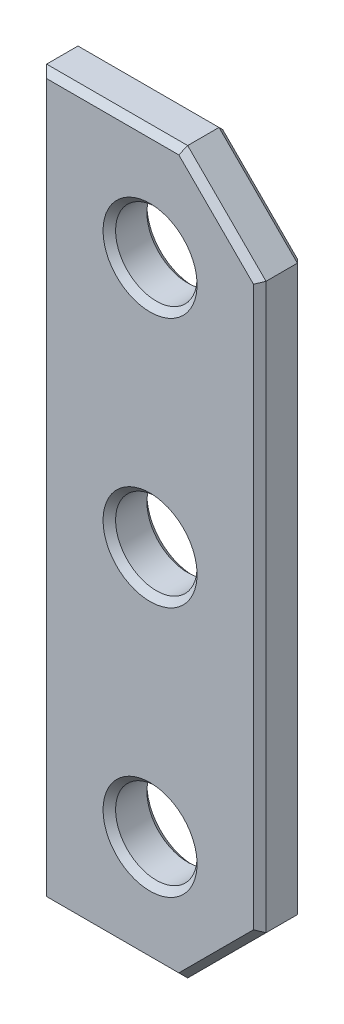
from build123d import *

# Parameters (mm, degrees)
SKETCH_1_R        = 13
EXTRUDE_408_DEPTH = 14
CHAMFER_1_SIZE    = 2


with BuildPart() as part:
    # 草图1 → Extrude 408 (new body)
    with BuildSketch(Plane.XY):
        Polygon((0, 0), (45, 0), (70, 25), (70, 205), (45, 230), (0, 230), align=None)
        with Locations((35, 35)):
            Circle(SKETCH_1_R, mode=Mode.SUBTRACT)
        with Locations((35, 115)):
            Circle(SKETCH_1_R, mode=Mode.SUBTRACT)
        with Locations((35, 195)):
            Circle(SKETCH_1_R, mode=Mode.SUBTRACT)
    extrude(amount=EXTRUDE_408_DEPTH)

    # 倒角1
    chamfer_1_edges = [part.edges().sort_by_distance(p)[0] for p in [
        (57.5, 12.5, 14),
        (70, 115, 14),
        (57.5, 217.5, 14),
        (22, 35, 0),
        (22, 35, 14),
        (22.5, 230, 14),
        (22, 115, 0),
        (22, 115, 14),
        (22, 195, 0),
        (22, 195, 14),
        (0, 115, 14),
        (22.5, 230, 0),
        (57.5, 217.5, 0),
        (70, 115, 0),
        (22.5, 0, 14),
        (57.5, 12.5, 0),
        (22.5, 0, 0),
        (0, 115, 0),
    ]]
    chamfer(chamfer_1_edges, length=CHAMFER_1_SIZE)


solid = part.part
